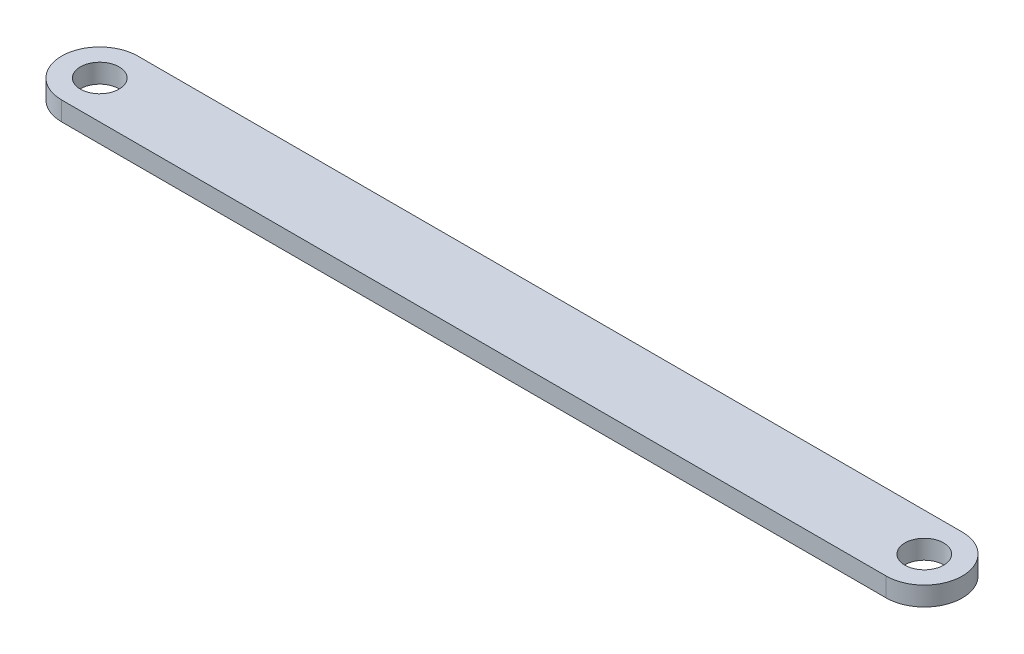
from build123d import *

# Parameters (mm, degrees)
SKETCH1_R           = 3.05
BOSS_EXTRUDE1_DEPTH = 3


with BuildPart() as part:
    # Sketch1 → Boss-Extrude1 (new body)
    with BuildSketch(Plane(origin=(0, 0, 0), x_dir=(1, 0, 0), z_dir=(0, 1, 0))):
        with BuildLine():
            Line((0, 6), (130, 6))
            ThreePointArc((130, 6), (136, 0), (130, -6))
            Line((130, -6), (0, -6))
            ThreePointArc((0, -6), (-6, 0), (0, 6))
        make_face()
        with Locations(Location((0, 0, 0), (0, 0, 270))):
            Circle(SKETCH1_R, mode=Mode.SUBTRACT)
        with Locations(Location((130, 0, 0), (0, 0, 270))):
            Circle(SKETCH1_R, mode=Mode.SUBTRACT)
    extrude(amount=BOSS_EXTRUDE1_DEPTH)


solid = part.part
